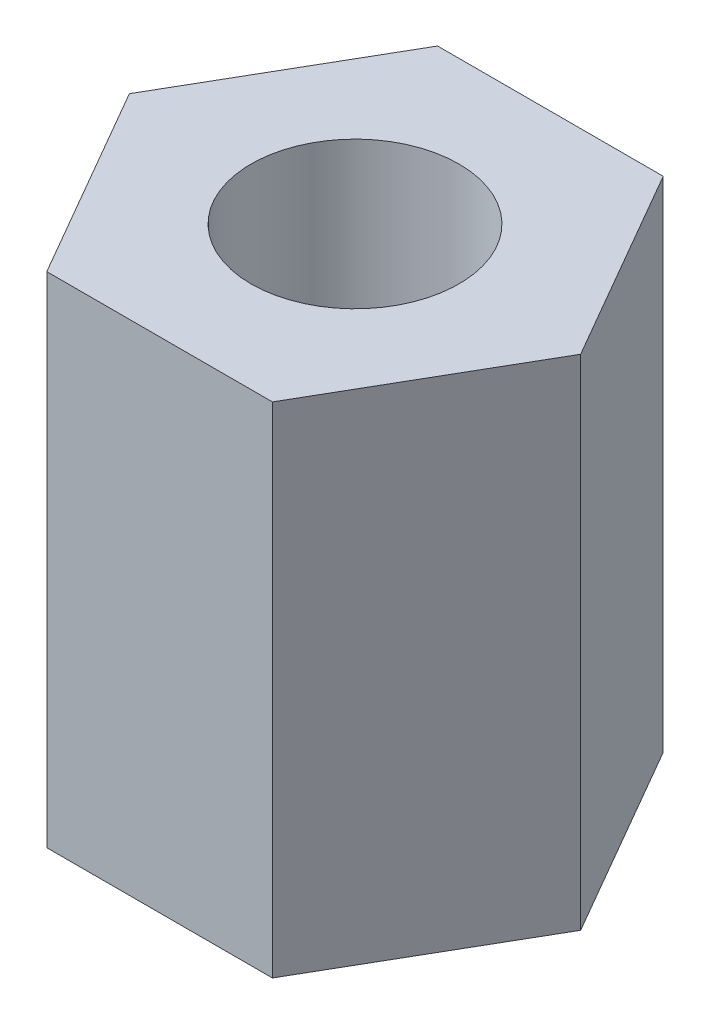
from build123d import *

# Parameters (mm, degrees)
SKETCH1_R           = 1.25
BOSS_EXTRUDE1_DEPTH = 6


with BuildPart() as part:
    # Sketch1 → Boss-Extrude1 (new body)
    with BuildSketch(Plane(origin=(0, 0, 0), x_dir=(1, 0, 0), z_dir=(0, 1, 0))):
        Polygon((2.713546265, 0), (1.356773133, 2.35), (-1.356773133, 2.35), (-2.713546265, 0), (-1.356773133, -2.35), (1.356773133, -2.35), align=None)
        with Locations(Location((0, 0, 0), (0, 0, 270))):
            Circle(SKETCH1_R, mode=Mode.SUBTRACT)
    extrude(amount=BOSS_EXTRUDE1_DEPTH)


solid = part.part
